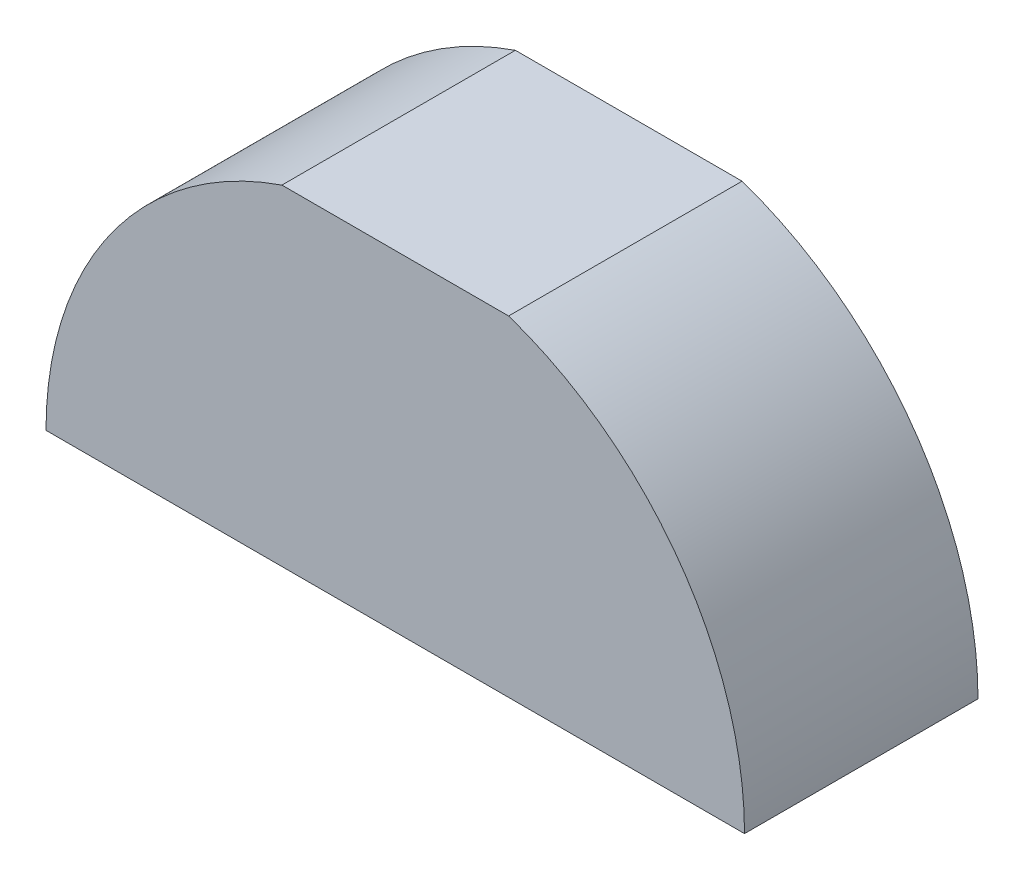
from build123d import *

# Parameters (mm, degrees)
BOSS_EXTRUDE2_DEPTH     = 3.175
CUT_EXTRUDE2_DEPTH      = 12.261894646
CUT_EXTRUDE2_DEPTH_BACK = 12.261894646


with BuildPart() as part:
    # Sketch2 → Boss-Extrude2 (new body)
    with BuildSketch(Plane.XY):
        with BuildLine():
            Line((-9.705104119, 0), (-0.205504119, 0))
            ThreePointArc((-0.205504119, 0), (-4.955304119, 4.7498), (-9.705104119, 0))
        make_face()
    extrude(amount=BOSS_EXTRUDE2_DEPTH)

    # Sketch5 → Cut-Extrude2 (cut, two sides: drawn at the far end of the back side and taken through both)
    with BuildSketch(Plane.XY.offset(-CUT_EXTRUDE2_DEPTH_BACK)):
        Polygon((-31.958349857, 4.492702415), (-6.496805029, 4.492702415), (-3.41380321, 4.492702415), (22.047741618, 4.492702415), (22.047741618, 55.415792071), (-31.958349857, 55.415792071), align=None)
    extrude(amount=CUT_EXTRUDE2_DEPTH + CUT_EXTRUDE2_DEPTH_BACK, mode=Mode.SUBTRACT)


solid = part.part
